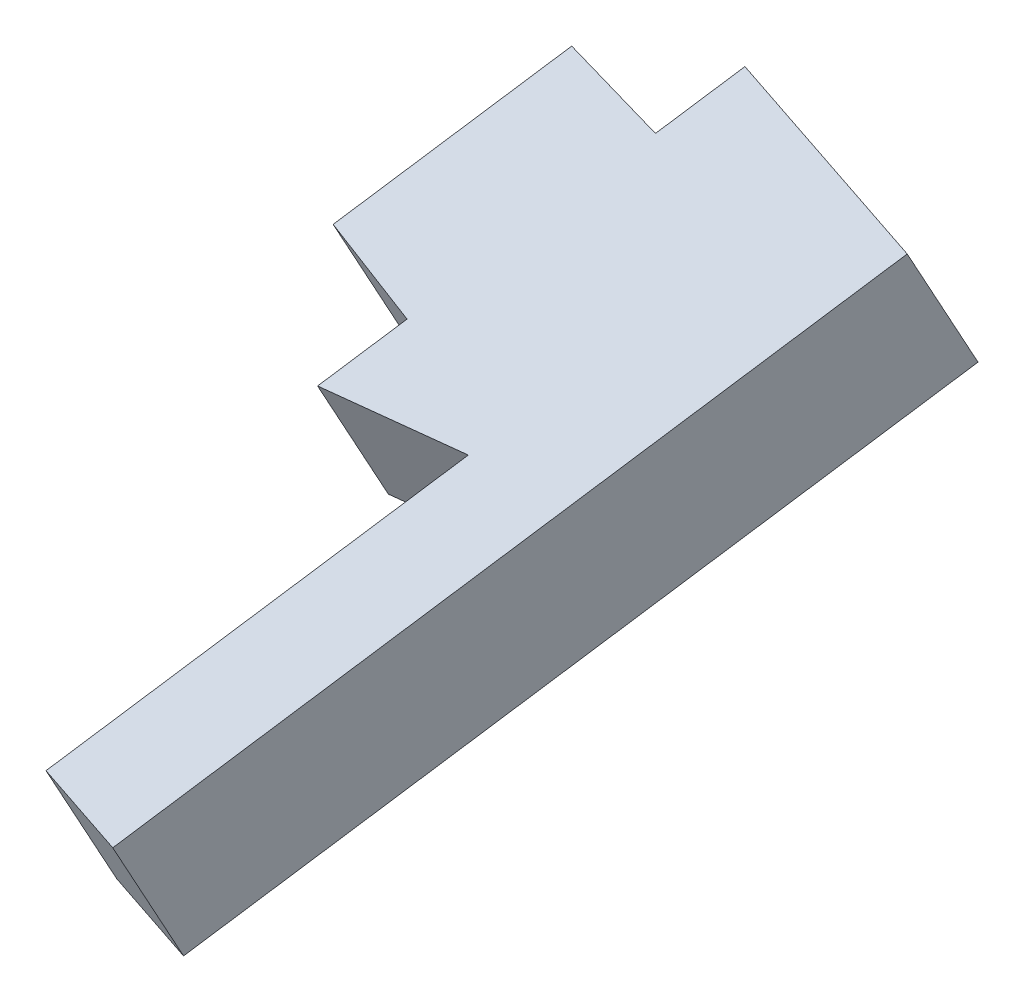
from build123d import *

# Parameters (mm, degrees)
BOSS_EXTRUDE1_DEPTH = 3


with BuildPart() as part:
    # Sketch1 → Boss-Extrude1 (new, symmetric)
    with BuildSketch(Plane(origin=(-30.283899698, 190.565141588, 90.851699095), x_dir=(0.9895658040523138, 0.13875740324000221, 0.03880595954733255), z_dir=(-0.14199461682965575, 0.8935184877292665, 0.42598385048896426))):
        Polygon((-20.644604007, 121.698961188), (-17.504977468, 131.361690885), (-11.733894079, 129.706850383), (-10.556534127, 133.33037402), (1.189008368, 129.513997272), (-9.266172958, 97.336415059), (-14.097537806, 98.906228328), (-8.540260065, 116.00968697), (-16.180374478, 116.022057732), (-15.003014526, 119.645581368), align=None)
    extrude(amount=BOSS_EXTRUDE1_DEPTH, both=True)


solid = part.part
